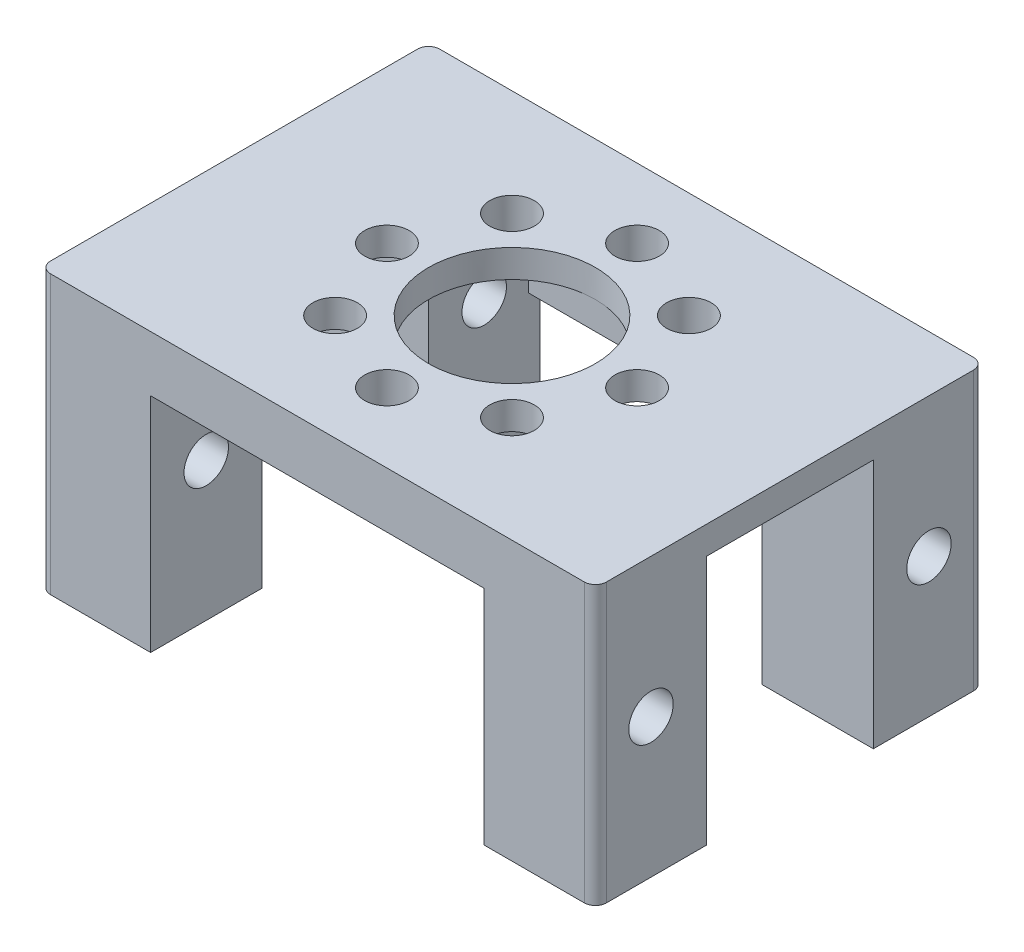
from build123d import *

# Parameters (mm, degrees)
ESBO_O1_W                = 100
ESBO_O1_H                = 70
RESSALTO_EXTRUS_O1_DEPTH = 50
ESBO_O2_W                = 30
ESBO_O2_H                = 90
CORTE_EXTRUS_O1_DEPTH    = 239
ESBO_O3_R                = 4
CORTE_EXTRUS_O2_DEPTH    = 100
CORTE_EXTRUS_O3_REACH    = 133.909
ESBO_O4_W                = 60
ESBO_O4_H                = 80
FILETE2_R                = 2
FILETE3_R                = 2
ESBO_O5_R                = 15
CORTE_EXTRUS_O4_DEPTH    = 5
ESBO_O6_R                = 4
CORTE_EXTRUS_O7_DEPTH    = 239
PADR_OCIRCULAR1_COUNT    = 8


with BuildPart() as part:
    # Esboço1 → Ressalto-extrusão1 (new body)
    with BuildSketch(Plane(origin=(0, 0, 0), x_dir=(1, 0, 0), z_dir=(0, 1, 0))):
        with Locations((50, 35)):
            Rectangle(ESBO_O1_W, ESBO_O1_H)
    extrude(amount=-RESSALTO_EXTRUS_O1_DEPTH)

    # Esboço2 → Corte-extrusão1 (cut)
    with BuildSketch(Plane(origin=(0, 0, 0), x_dir=(0, 0, -1), z_dir=(1, 0, 0))):
        with Locations((35, -50)):
            Rectangle(ESBO_O2_W, ESBO_O2_H)
    extrude(amount=CORTE_EXTRUS_O1_DEPTH, mode=Mode.SUBTRACT)

    # Esboço3 → Corte-extrusão2 (cut)
    with BuildSketch(Plane(origin=(100, 0, 0), x_dir=(0, 0, -1), z_dir=(1, 0, 0))):
        with Locations((10, -25)):
            Circle(ESBO_O3_R)
        with Locations((60, -25)):
            Circle(ESBO_O3_R)
    extrude(amount=-CORTE_EXTRUS_O2_DEPTH, mode=Mode.SUBTRACT)

    # Corte-extrusão3: up to this face of the body (flat: up to its plane)
    corte_extrus_o3_end = Plane(part.part.faces().sort_by_distance((50, -25, -70))[0])
    # Esboço4 → Corte-extrusão3 (cut, up to the picked face)
    with BuildSketch(Plane.XY, mode=Mode.PRIVATE) as corte_extrus_o3_sk1:
        with Locations((50, -50)):
            Rectangle(ESBO_O4_W, ESBO_O4_H)
    corte_extrus_o3_tool1 = split(extrude(corte_extrus_o3_sk1.sketch, amount=-CORTE_EXTRUS_O3_REACH, mode=Mode.PRIVATE), bisect_by=corte_extrus_o3_end, keep=Keep.BOTH, mode=Mode.PRIVATE)
    add(corte_extrus_o3_tool1.solids().sort_by(Axis((50, -50, 0), (0, 0, -1)))[0], mode=Mode.SUBTRACT)

    # Filete2
    filete2_edges = [part.edges().sort_by_distance(p)[0] for p in [
        (0, -25, -70),
    ]]
    fillet(filete2_edges, radius=FILETE2_R)

    # Filete3
    filete3_edges = [part.edges().sort_by_distance(p)[0] for p in [
        (100, -25, -70),
        (100, -25, 0),
        (0, -25, 0),
    ]]
    fillet(filete3_edges, radius=FILETE3_R)

    # Esboço5 → Corte-extrusão4 (cut)
    with BuildSketch(Plane(origin=(0, 0, 0), x_dir=(1, 0, 0), z_dir=(0, 1, 0))):
        with Locations(Location((50, 35, 0), (0, 0, 270))):
            Circle(ESBO_O5_R)
    extrude(amount=-CORTE_EXTRUS_O4_DEPTH, mode=Mode.SUBTRACT)

    # Esboço6 → Corte-extrusão7 (cut)
    with BuildSketch(Plane(origin=(0, 0, 0), x_dir=(1, 0, 0), z_dir=(0, 1, 0))):
        with Locations(Location((50, 57.5, 0), (0, 0, 270))):
            Circle(ESBO_O6_R)
    corte_extrus_o7 = extrude(amount=-CORTE_EXTRUS_O7_DEPTH, mode=Mode.SUBTRACT)

    # PadrãoCircular1: Corte-extrusão7 ×8 about axis
    padr_ocircular1_axis = Axis((50, 0, -35), (0, 1, 0))
    for i in range(1, PADR_OCIRCULAR1_COUNT):
        add(corte_extrus_o7.rotate(padr_ocircular1_axis, i * 360 / PADR_OCIRCULAR1_COUNT), mode=Mode.SUBTRACT)


solid = part.part
